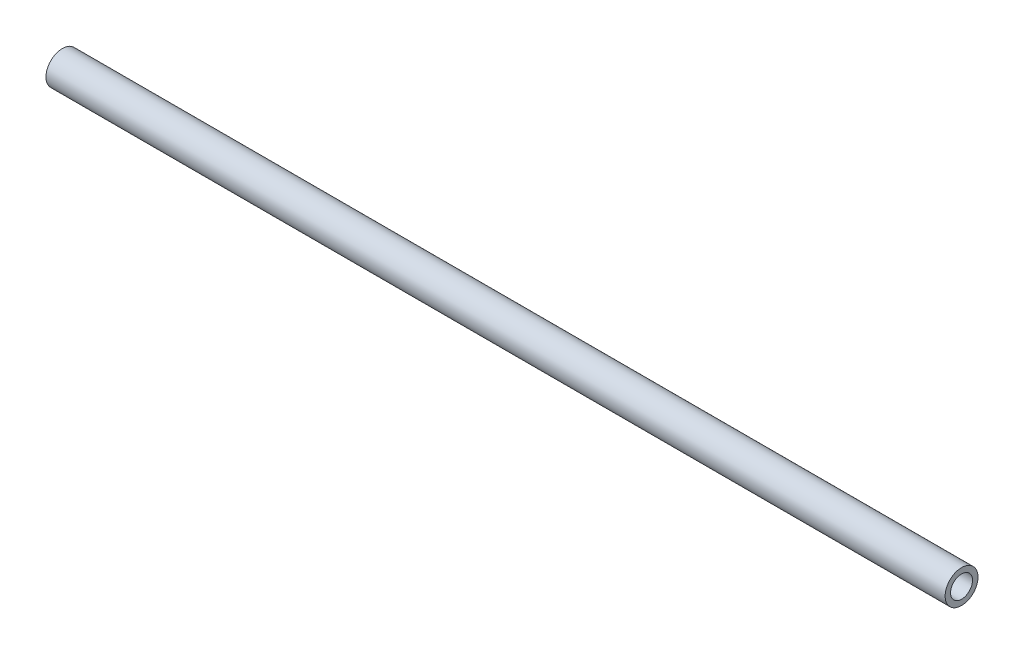
from build123d import *

# Parameters (mm, degrees)
ESQUISSE1_R        = 3
ESQUISSE1_R_2      = 2
EXTRU_MINCE1_DEPTH = 82


with BuildPart() as part:
    # Esquisse1 → Extru.-Mince1 (new, symmetric)
    with BuildSketch(Plane(origin=(0, 0, 0), x_dir=(0, 0, -1), z_dir=(1, 0, 0))):
        Circle(ESQUISSE1_R)
        Circle(ESQUISSE1_R_2, mode=Mode.SUBTRACT)
    extrude(amount=EXTRU_MINCE1_DEPTH, both=True)


solid = part.part
